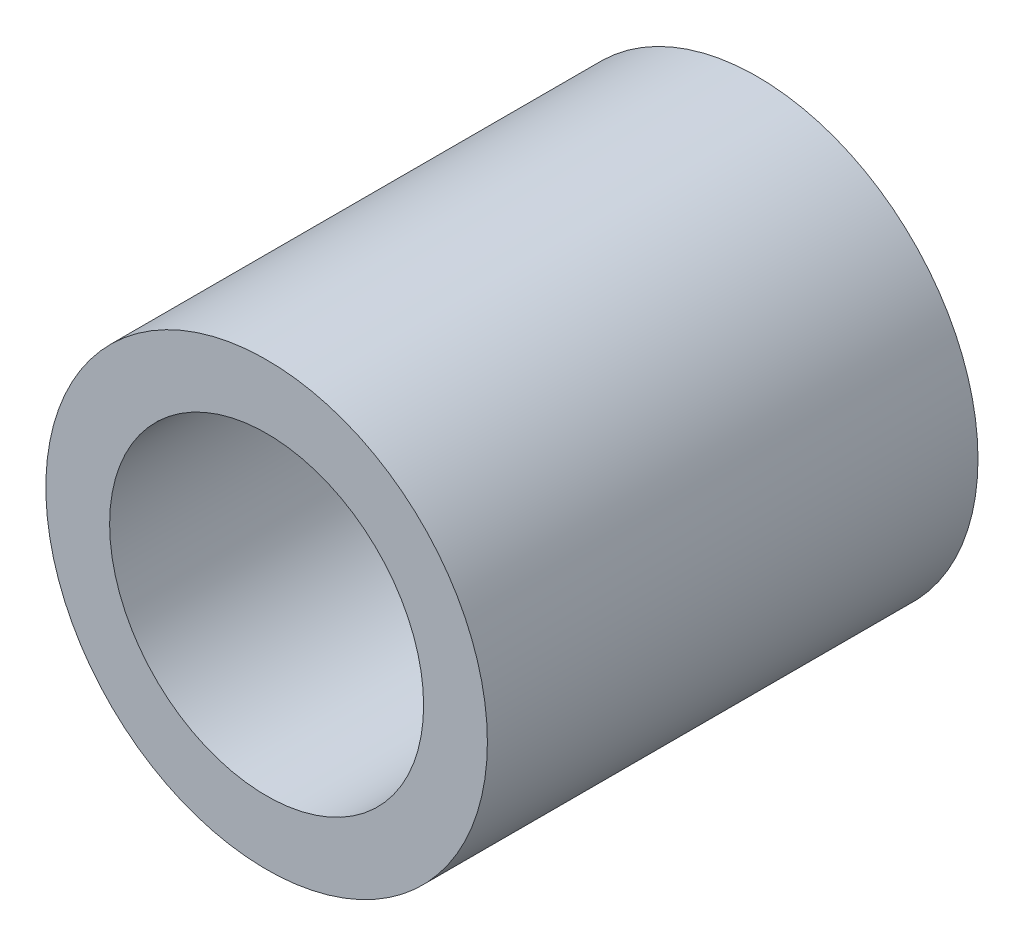
from build123d import *

# Parameters (mm, degrees)
SKETCH1_R      = 2.25
SKETCH1_R_2    = 1.6
EXTRUDE1_DEPTH = 2.5


with BuildPart() as part:
    # Sketch1 → Extrude1 (new, symmetric)
    with BuildSketch(Plane.XY):
        Circle(SKETCH1_R)
        Circle(SKETCH1_R_2, mode=Mode.SUBTRACT)
    extrude(amount=EXTRUDE1_DEPTH, both=True)


solid = part.part
